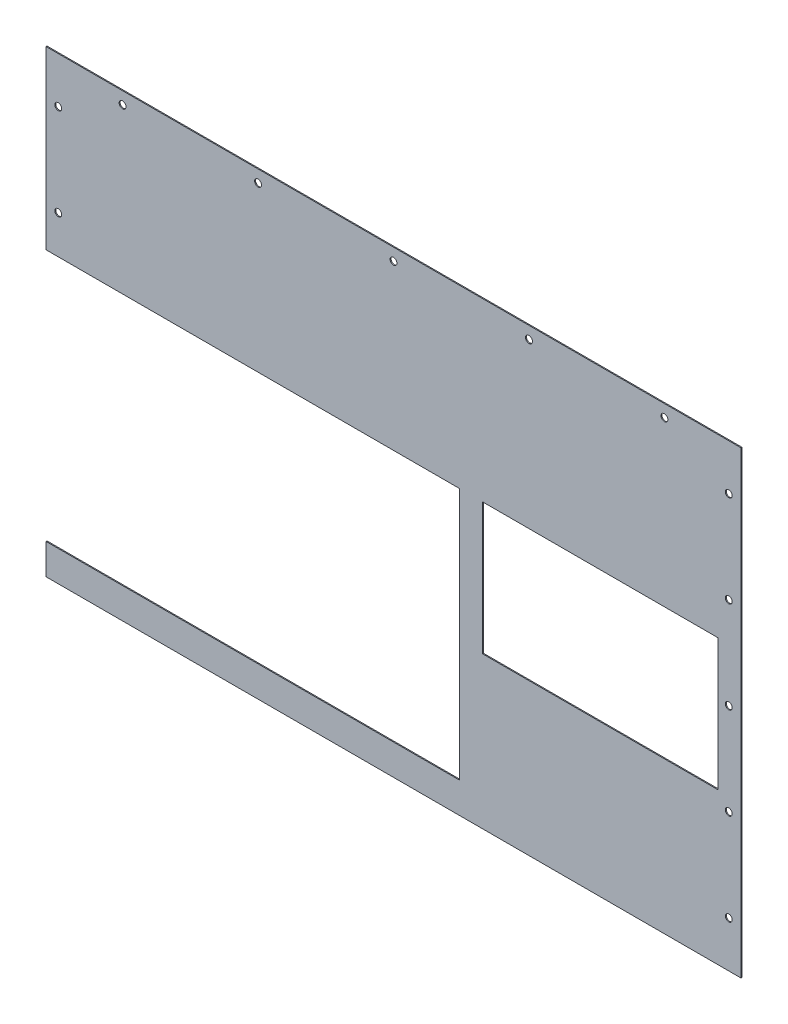
from build123d import *

# Parameters (mm, degrees)
SKETCH1_W               = 154
SKETCH1_H               = 86
BOSS_EXTRUDE1_DEPTH     = 0.635
SKETCH2_R               = 2.248
CUT_EXTRUDE3_DEPTH      = 342.301440511
LPATTERN1_COUNT         = 5
LPATTERN1_PITCH         = 88.5
SKETCH3_R               = 2.248
CUT_EXTRUDE5_DEPTH      = 342.301440511
LPATTERN2_COUNT         = 6
LPATTERN2_PITCH         = 60
MIRROR1_COPY_1_SKETCH_R = 2.248
MIRROR1_COPY_1_DEPTH    = 342.301440511
MIRROR1_COPY_2_SKETCH_R = 2.248
MIRROR1_COPY_2_DEPTH    = 342.301440511
MIRROR1_COPY_3_SKETCH_R = 2.248
MIRROR1_COPY_3_DEPTH    = 342.301440511
MIRROR1_COPY_4_SKETCH_R = 2.248
MIRROR1_COPY_4_DEPTH    = 342.301440511
MIRROR1_COPY_5_SKETCH_R = 2.248
MIRROR1_COPY_5_DEPTH    = 342.301440511
MIRROR1_COPY_6_SKETCH_R = 2.248
MIRROR1_COPY_6_DEPTH    = 342.301440511


with BuildPart() as part:
    # Sketch1 → Boss-Extrude1 (new body)
    with BuildSketch(Plane.XY):
        Polygon((-283.600620106, 189.886698706), (-283.600620106, 74.886698706), (-13.600620106, 74.886698706), (-13.600620106, -90.113301294), (-283.600620106, -90.113301294), (-283.600620106, -110.113301294), (170.399379894, -110.113301294), (170.399379894, 189.886698706), align=None)
        with Locations((78.399379894, 31.886698706)):
            Rectangle(SKETCH1_W, SKETCH1_H, mode=Mode.SUBTRACT)
    extrude(amount=BOSS_EXTRUDE1_DEPTH)

    # Sketch2 → Cut-Extrude3 (cut, through all)
    with BuildSketch(Plane.XY):
        with Locations((-233.600620106, 181.911698706)):
            Circle(SKETCH2_R)
    cut_extrude3 = extrude(amount=CUT_EXTRUDE3_DEPTH, mode=Mode.SUBTRACT)

    # LPattern1: Cut-Extrude3 ×5
    with Locations(*[(i * LPATTERN1_PITCH, 0, 0) for i in range(1, LPATTERN1_COUNT)]):
        add(cut_extrude3, mode=Mode.SUBTRACT)

    # Sketch3 → Cut-Extrude5 (cut, through all)
    with BuildSketch(Plane.XY):
        with Locations((-275.625620106, 159.886698706)):
            Circle(SKETCH3_R)
    cut_extrude5 = extrude(amount=CUT_EXTRUDE5_DEPTH, mode=Mode.SUBTRACT)

    # LPattern2: Cut-Extrude5 ×6
    with Locations(*[(0, -i * LPATTERN2_PITCH, 0) for i in range(1, LPATTERN2_COUNT)]):
        add(cut_extrude5, mode=Mode.SUBTRACT)

    # Mirror1 copy 1 sketch → Mirror1 copy 1 (cut, through all)
    with BuildSketch(Plane(origin=(-113.201240213, -60, 0), x_dir=(-1, 0, 0), z_dir=(0, 0, 1))):
        with Locations((-275.625620106, -159.886698706)):
            Circle(MIRROR1_COPY_1_SKETCH_R)
    extrude(amount=MIRROR1_COPY_1_DEPTH, mode=Mode.SUBTRACT)

    # Mirror1 copy 2 sketch → Mirror1 copy 2 (cut, through all)
    with BuildSketch(Plane(origin=(-113.201240213, -120, 0), x_dir=(-1, 0, 0), z_dir=(0, 0, 1))):
        with Locations((-275.625620106, -159.886698706)):
            Circle(MIRROR1_COPY_2_SKETCH_R)
    extrude(amount=MIRROR1_COPY_2_DEPTH, mode=Mode.SUBTRACT)

    # Mirror1 copy 3 sketch → Mirror1 copy 3 (cut, through all)
    with BuildSketch(Plane(origin=(-113.201240213, -180, 0), x_dir=(-1, 0, 0), z_dir=(0, 0, 1))):
        with Locations((-275.625620106, -159.886698706)):
            Circle(MIRROR1_COPY_3_SKETCH_R)
    extrude(amount=MIRROR1_COPY_3_DEPTH, mode=Mode.SUBTRACT)

    # Mirror1 copy 4 sketch → Mirror1 copy 4 (cut, through all)
    with BuildSketch(Plane(origin=(-113.201240213, -240, 0), x_dir=(-1, 0, 0), z_dir=(0, 0, 1))):
        with Locations((-275.625620106, -159.886698706)):
            Circle(MIRROR1_COPY_4_SKETCH_R)
    extrude(amount=MIRROR1_COPY_4_DEPTH, mode=Mode.SUBTRACT)

    # Mirror1 copy 5 sketch → Mirror1 copy 5 (cut, through all)
    with BuildSketch(Plane(origin=(-113.201240213, -300, 0), x_dir=(-1, 0, 0), z_dir=(0, 0, 1))):
        with Locations((-275.625620106, -159.886698706)):
            Circle(MIRROR1_COPY_5_SKETCH_R)
    extrude(amount=MIRROR1_COPY_5_DEPTH, mode=Mode.SUBTRACT)

    # Mirror1 copy 6 sketch → Mirror1 copy 6 (cut, through all)
    with BuildSketch(Plane(origin=(-113.201240213, 0, 0), x_dir=(-1, 0, 0), z_dir=(0, 0, 1))):
        with Locations((-275.625620106, -159.886698706)):
            Circle(MIRROR1_COPY_6_SKETCH_R)
    extrude(amount=MIRROR1_COPY_6_DEPTH, mode=Mode.SUBTRACT)


solid = part.part
